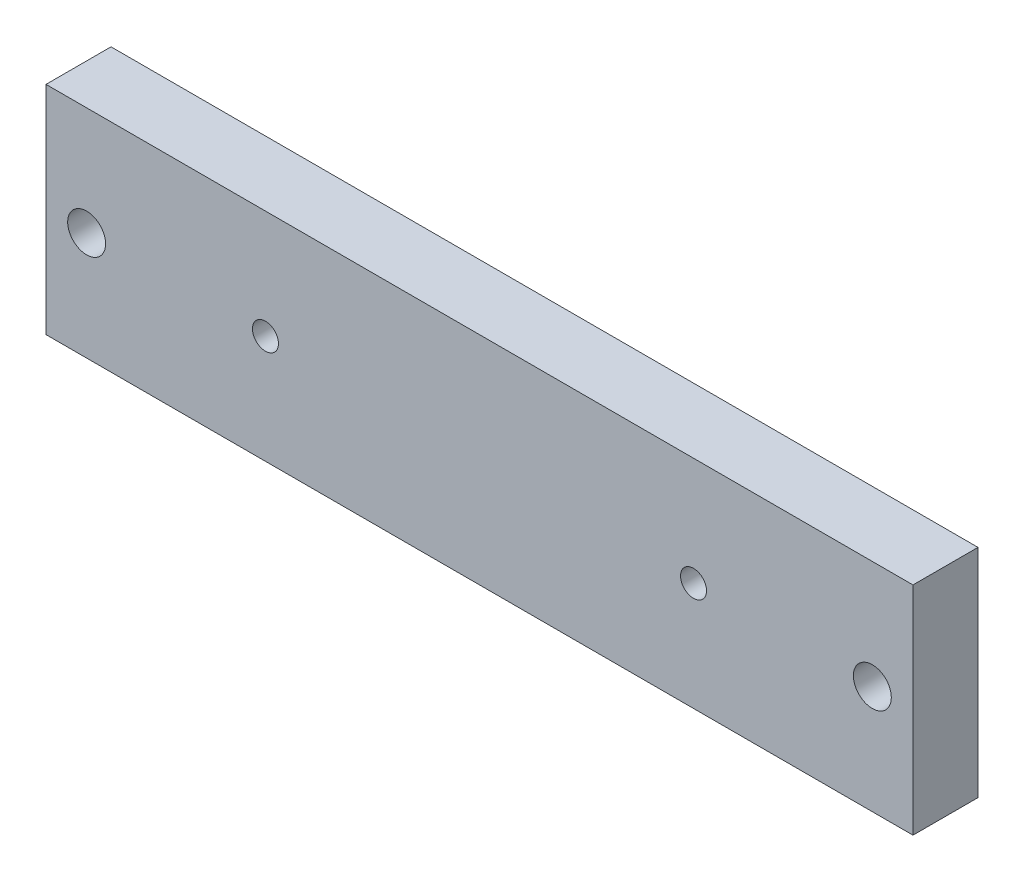
from build123d import *

# Parameters (mm, degrees)
SKETCH1_W                      = 160
SKETCH1_H                      = 40
BOSS_EXTRUDE1_DEPTH            = 12
M6_CLEARANCE_HOLE1_D           = 7
CBORE_FOR_M4_SHCS1_D           = 4.8
CBORE_FOR_M4_SHCS1_CBORE_D     = 8
CBORE_FOR_M4_SHCS1_CBORE_DEPTH = 4


with BuildPart() as part:
    # Sketch1 → Boss-Extrude1 (new body)
    with BuildSketch(Plane.XY):
        Rectangle(SKETCH1_W, SKETCH1_H)
    extrude(amount=BOSS_EXTRUDE1_DEPTH)

    # M6 Clearance Hole1 (through all)
    with Locations(Plane.XY.offset(12)):
        with Locations((-72.5, 0), (72.5, 0)):
            Hole(M6_CLEARANCE_HOLE1_D / 2)

    # CBORE for M4 SHCS1 (through all)
    with Locations(Plane(origin=(0, 0, 0), x_dir=(-1, 0, 0), z_dir=(0, 0, -1))):
        with Locations((-39.5, 0), (39.5, 0)):
            CounterBoreHole(CBORE_FOR_M4_SHCS1_D / 2, CBORE_FOR_M4_SHCS1_CBORE_D / 2, CBORE_FOR_M4_SHCS1_CBORE_DEPTH)


solid = part.part
